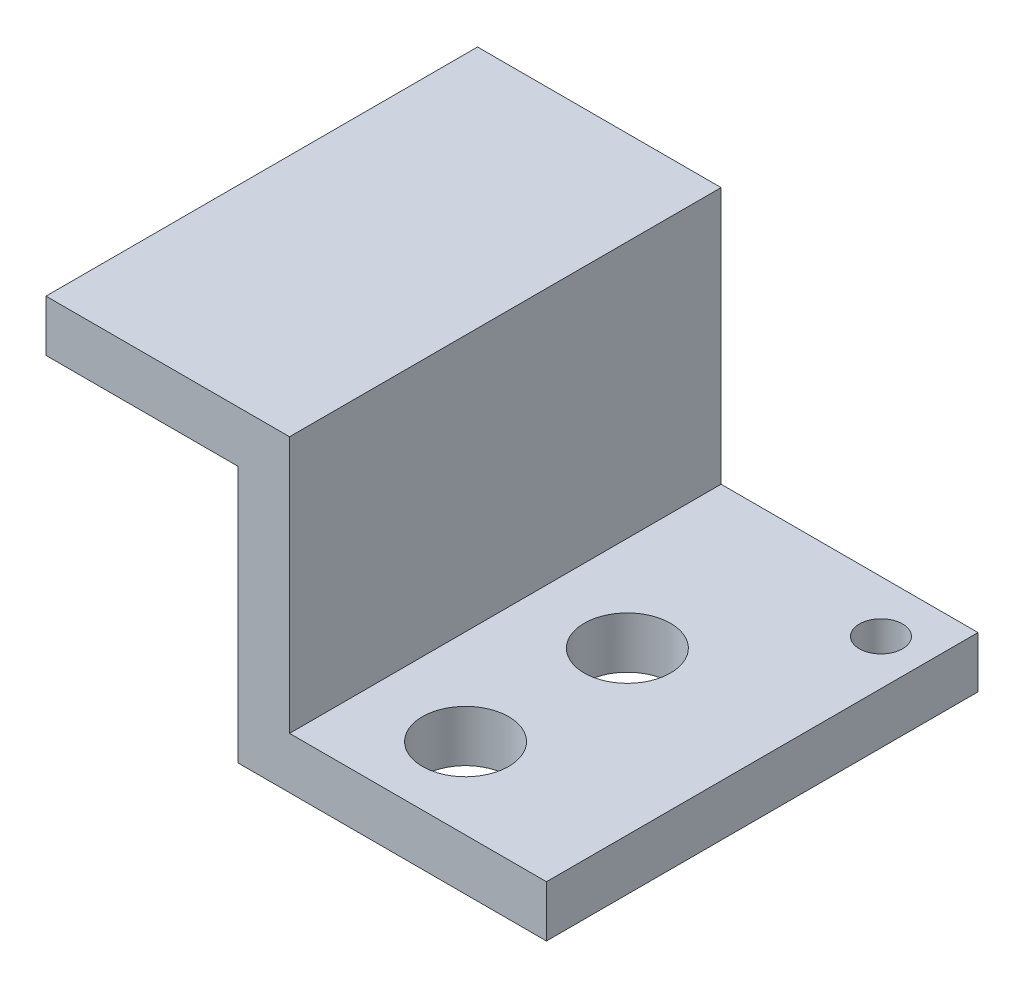
from build123d import *

# Parameters (mm, degrees)
BOSS_EXTRUDE1_DEPTH = 40
SKETCH4_W           = 6
SKETCH4_H           = 40
CUT_EXTRUDE1_DEPTH  = 4.7625
SKETCH5_R           = 2
SKETCH5_R_2         = 4
CUT_EXTRUDE2_DEPTH  = 4.7625


with BuildPart() as part:
    # Sketch3 → Boss-Extrude1 (new body)
    with BuildSketch(Plane.XY):
        Polygon((26.19375, -9.525), (26.19375, -14.2875), (-2.38125, -14.2875), (-2.38125, 9.525), (-26.19375, 9.525), (-26.19375, 14.2875), (2.38125, 14.2875), (2.38125, -9.525), align=None)
    extrude(amount=BOSS_EXTRUDE1_DEPTH)

    # Sketch4 → Cut-Extrude1 (cut)
    with BuildSketch(Plane(origin=(0, 14.2875, 0), x_dir=(1, 0, 0), z_dir=(0, 1, 0))):
        with Locations((-23.19375, -20)):
            Rectangle(SKETCH4_W, SKETCH4_H)
    extrude(amount=-CUT_EXTRUDE1_DEPTH, mode=Mode.SUBTRACT)

    # Sketch5 → Cut-Extrude2 (cut)
    with BuildSketch(Plane.XZ.offset(14.2875)):
        with Locations(Location((22.0033493, 4.8026184, 0), (0, 0, 270))):
            Circle(SKETCH5_R)
        with Locations(Location((11.19375, 17.5, 0), (0, 0, 270))):
            Circle(SKETCH5_R_2)
        with Locations(Location((11.19375, 32.5, 0), (0, 0, 270))):
            Circle(SKETCH5_R_2)
    extrude(amount=-CUT_EXTRUDE2_DEPTH, mode=Mode.SUBTRACT)


solid = part.part
